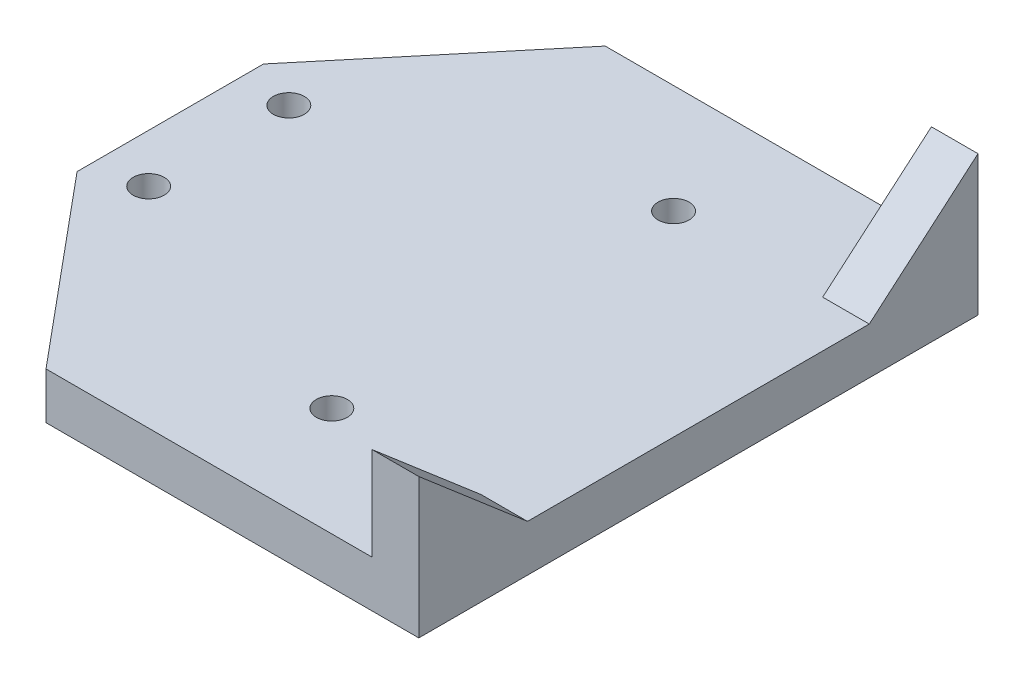
from build123d import *

# Parameters (mm, degrees)
BOSS_EXTRUDE1_DEPTH   = 15
F_1_0MM_DOWEL_HOLE1_D = 10
BOSS_EXTRUDE2_DEPTH   = 15
ESCALA1_SCALE         = 0.2


with BuildPart() as part:
    # Sketch2 → Boss-Extrude1 (new body)
    with BuildSketch(Plane(origin=(0, 0, 0), x_dir=(1, 0, 0), z_dir=(0, 1, 0))):
        Polygon((-220, 30), (-220, -30), (-170, -90), (-50, -90), (-50, 90), (-170, 90), align=None)
    extrude(amount=BOSS_EXTRUDE1_DEPTH)

    # Ø1.0mm Dowel Hole1 (through all)
    with Locations(Plane(origin=(0, 15, 0), x_dir=(1, 0, 0), z_dir=(0, 1, 0))):
        with Locations((-204.389232105, 22.557395049), (-204.389232105, -22.557395049), (-112.996294866, 55), (-112.996294866, -55)):
            Hole(F_1_0MM_DOWEL_HOLE1_D / 2)

    # Sketch5 → Boss-Extrude2 (add)
    with BuildSketch(Plane(origin=(-50, 0, 0), x_dir=(0, 0, -1), z_dir=(1, 0, 0))):
        Polygon((-90, 15), (-55, 15), (-90, 45), align=None)
        Polygon((90, 45), (90, 15), (55, 15), align=None)
    extrude(amount=-BOSS_EXTRUDE2_DEPTH)


with BuildPart() as part_1:
    # Escala1: scaled about (-124.630859944, 8.148472024, 0)
    add(part.part.scale(ESCALA1_SCALE).moved(Location((-99.704687955, 6.518777619, 0))))


solid = part_1.part
